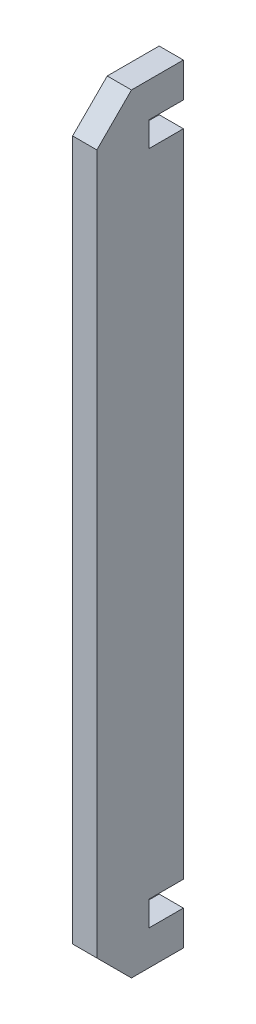
from build123d import *

# Parameters (mm, degrees)
SKETCH1_W           = 46.95
SKETCH1_H           = 5
BOSS_EXTRUDE1_DEPTH = 3.5
CHAMFER1_SIZE       = 5


with BuildPart() as part:
    # Sketch1 → Boss-Extrude1 (new body)
    with BuildSketch(Plane.YZ):
        Polygon((-21.521641791, 5.223880597), (-17.921641791, 5.223880597), (29.028358209, 5.223880597), (75.978358209, 5.223880597), (79.578358209, 5.223880597), (79.578358209, 0.223880597), (84.578358209, 0.223880597), (84.578358209, 12.723880597), (-26.521641791, 12.723880597), (-26.521641791, 0.223880597), (-21.521641791, 0.223880597), align=None)
        with Locations((5.553358209, 2.723880597)):
            Rectangle(SKETCH1_W, SKETCH1_H)
        with Locations((52.503358209, 2.723880597)):
            Rectangle(SKETCH1_W, SKETCH1_H)
    extrude(amount=BOSS_EXTRUDE1_DEPTH)

    # Chamfer1
    chamfer1_edges = [part.edges().sort_by_distance(p)[0] for p in [
        (1.75, -26.521641791, 12.723880597),
        (1.75, 84.578358209, 12.723880597),
    ]]
    chamfer(chamfer1_edges, length=CHAMFER1_SIZE)


solid = part.part
